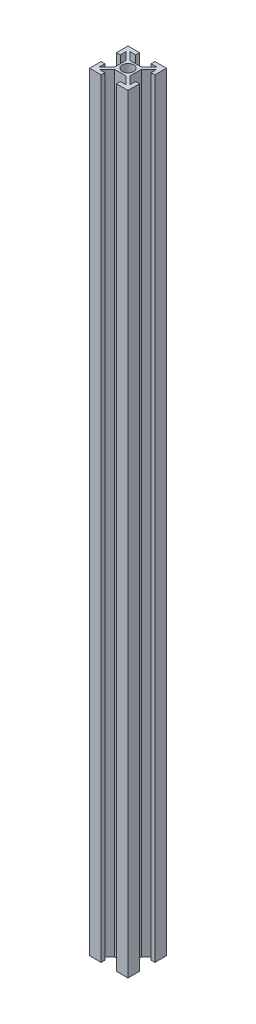
from build123d import *

# Parameters (mm, degrees)
F_2020_SKETCH_R     = 3
BOSS_EXTRUDE1_DEPTH = 400


with BuildPart() as part:
    # 2020 sketch → Boss-Extrude1 (new body)
    with BuildSketch(Plane(origin=(0, 0, 0), x_dir=(1, 0, 0), z_dir=(0, 1, 0))):
        Polygon((-4, 10), (-4, 8), (-7, 8), (-3, 4), (3, 4), (7, 8), (4, 8), (4, 10), (10, 10), (10, 4), (8, 4), (8, 7), (4, 3), (4, -3), (8, -7), (8, -4), (10, -4), (10, -10), (4, -10), (4, -8), (7, -8), (3, -4), (-3, -4), (-7, -8), (-4, -8), (-4, -10), (-10, -10), (-10, -4), (-8, -4), (-8, -7), (-4, -3), (-4, 3), (-8, 7), (-8, 4), (-10, 4), (-10, 10), align=None)
        with Locations(Location((0, 0, 0), (0, 0, 270))):
            Circle(F_2020_SKETCH_R, mode=Mode.SUBTRACT)
    extrude(amount=BOSS_EXTRUDE1_DEPTH)


solid = part.part
